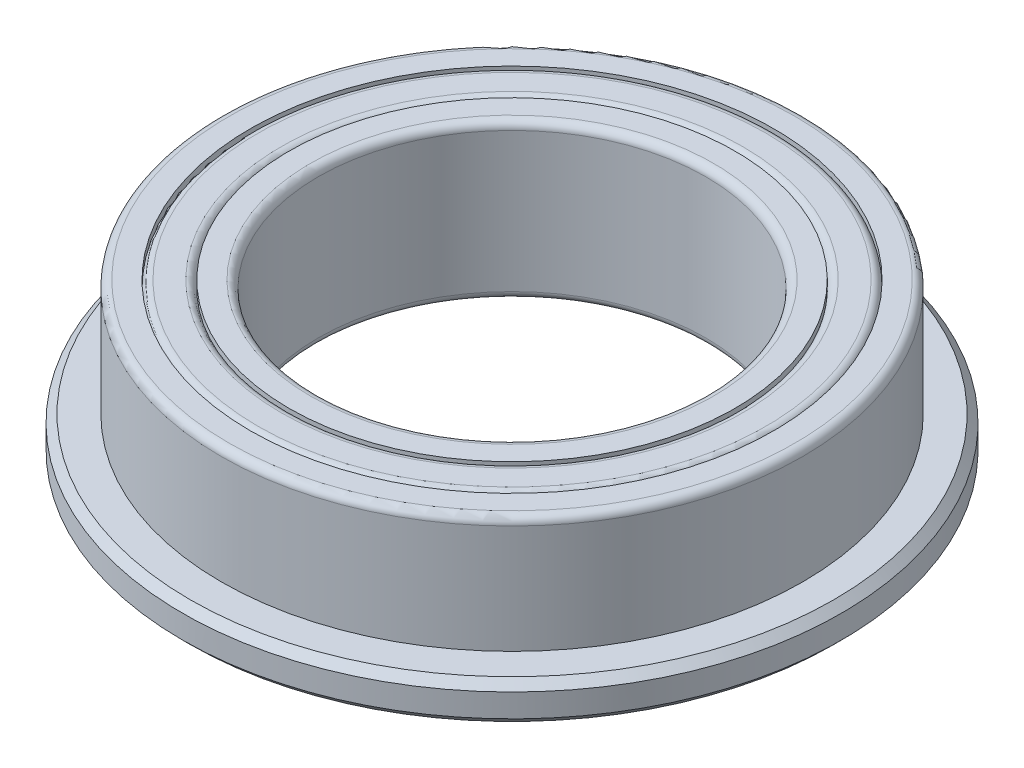
from build123d import *

# Parameters (mm, degrees)
SKETCH_1_R        = 6.75
SKETCH_1_R_2      = 5.75
EXTRUDE_1_DEPTH   = 4
SKETCH_1_3_R      = 7.5
SKETCH_1_3_R_2    = 6.75
EXTRUDE_2_DEPTH   = 4
SKETCH_1_3_R_3    = 5.75
SKETCH_1_3_R_4    = 5
EXTRUDE_2_2_DEPTH = 4
SKETCH_1_4_R      = 8.5
SKETCH_1_4_R_2    = 7.5
EXTRUDE_3_DEPTH   = 1
FILLET_1_R        = 0.2
FILLET_2_R        = 0.2
CHAMFER_1_SIZE    = 0.2
FILLET_4_R        = 0.2


with BuildPart() as part:
    # 草图1 → 凸台-拉伸1 (new body)
    with BuildSketch(Plane(origin=(0, 0, 0), x_dir=(1, 0, 0), z_dir=(0, 1, 0))):
        Circle(SKETCH_1_R)
        Circle(SKETCH_1_R_2, mode=Mode.SUBTRACT)
    extrude(amount=EXTRUDE_1_DEPTH)

    # 圆角1
    fillet_1_edges = [part.edges().sort_by_distance(p)[0] for p in [
        (-6.75, 0, 0),
        (-5.75, 0, 0),
        (-6.75, 4, 0),
        (-5.75, 4, 0),
    ]]
    fillet(fillet_1_edges, radius=FILLET_1_R)


with BuildPart() as body_2:
    # 草图1<3> → 凸台-拉伸2 (new body)
    with BuildSketch(Plane(origin=(0, 0, 0), x_dir=(1, 0, 0), z_dir=(0, 1, 0))):
        Circle(SKETCH_1_3_R)
        Circle(SKETCH_1_3_R_2, mode=Mode.SUBTRACT)
    extrude(amount=EXTRUDE_2_DEPTH)

    # 圆角4
    fillet_4_edges = [body_2.edges().sort_by_distance(p)[0] for p in [
        (-7.5, 4, 0),
    ]]
    fillet(fillet_4_edges, radius=FILLET_4_R)


with BuildPart() as body_3:
    # 草图1<3> → Extrude 2 2 (new body)
    with BuildSketch(Plane(origin=(0, 0, 0), x_dir=(1, 0, 0), z_dir=(0, 1, 0))):
        Circle(SKETCH_1_3_R_3)
        Circle(SKETCH_1_3_R_4, mode=Mode.SUBTRACT)
    extrude(amount=EXTRUDE_2_2_DEPTH)

    # 圆角2
    fillet_2_edges = [body_3.edges().sort_by_distance(p)[0] for p in [
        (-5, 0, 0),
        (-5, 4, 0),
    ]]
    fillet(fillet_2_edges, radius=FILLET_2_R)


with BuildPart() as body_4:
    # 草图1<4> → 凸台-拉伸3 (new body)
    with BuildSketch(Plane(origin=(0, 0, 0), x_dir=(1, 0, 0), z_dir=(0, 1, 0))):
        Circle(SKETCH_1_4_R)
        Circle(SKETCH_1_4_R_2, mode=Mode.SUBTRACT)
    extrude(amount=EXTRUDE_3_DEPTH)

    # 倒角1
    chamfer_1_edges = [body_4.edges().sort_by_distance(p)[0] for p in [
        (-8.5, 1, 0),
        (-8.5, 0, 0),
    ]]
    chamfer(chamfer_1_edges, length=CHAMFER_1_SIZE)


solid = Compound([part.part, body_2.part, body_3.part, body_4.part])
